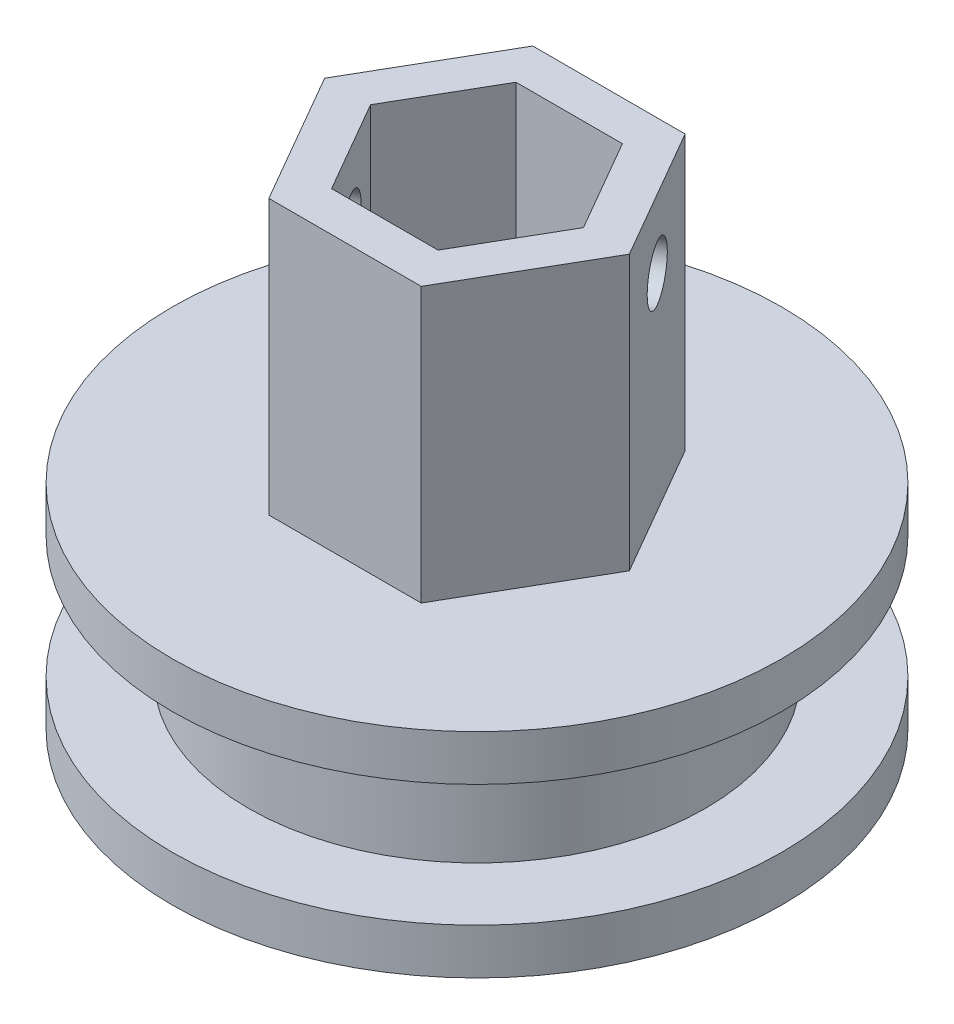
from build123d import *

# Parameters (mm, degrees)
EXTRUDE_3_DEPTH     = 18
SKETCH_2_R          = 1.8
CUT_EXTRUDE_1_DEPTH = 17.325
SKETCH_4_R          = 20
SKETCH_4_R_2        = 1.75
EXTRUDE_4_DEPTH     = 3
SKETCH_5_R          = 15
SKETCH_5_R_2        = 1.75
EXTRUDE_5_DEPTH     = 8
SKETCH_6_R          = 20
SKETCH_6_R_2        = 1.75
EXTRUDE_6_DEPTH     = 3


with BuildPart() as part:
    # 草图1 → 凸台-拉伸3 (new body)
    with BuildSketch(Plane(origin=(0, 0, 0), x_dir=(1, 0, 0), z_dir=(0, 1, 0))):
        Polygon((10, 0), (5, 8.660254038), (-5, 8.660254038), (-10, 0), (-5, -8.660254038), (5, -8.660254038), align=None)
        Polygon((6.985938257, 0), (3.492969129, 6.05), (-3.492969129, 6.05), (-6.985938257, 0), (-3.492969129, -6.05), (3.492969129, -6.05), align=None, mode=Mode.SUBTRACT)
    extrude(amount=-EXTRUDE_3_DEPTH)

    # 草图2 → 切除-拉伸1 (cut)
    with BuildSketch(Plane(origin=(7.5, 0, -4.330127019), x_dir=(-0.5000000000000003, 0, -0.8660254037844386), z_dir=(0.8660254037844386, 0, -0.5000000000000003))):
        with Locations((0, -4.5)):
            Circle(SKETCH_2_R)
    extrude(amount=-CUT_EXTRUDE_1_DEPTH, mode=Mode.SUBTRACT)

    # 草图4 → 凸台-拉伸4 (add)
    with BuildSketch(Plane.XZ.offset(18)):
        with Locations(Location((0, 0, 0), (0, 0, 270))):
            Circle(SKETCH_4_R)
        with Locations(Location((0, 0, 0), (0, 0, 270))):
            Circle(SKETCH_4_R_2, mode=Mode.SUBTRACT)
    extrude(amount=EXTRUDE_4_DEPTH)

    # 草图5 → 凸台-拉伸5 (add)
    with BuildSketch(Plane.XZ.offset(21)):
        with Locations(Location((0, 0, 0), (0, 0, 270))):
            Circle(SKETCH_5_R)
        with Locations(Location((0, 0, 0), (0, 0, 270))):
            Circle(SKETCH_5_R_2, mode=Mode.SUBTRACT)
    extrude(amount=EXTRUDE_5_DEPTH)

    # 草图6 → 凸台-拉伸6 (add)
    with BuildSketch(Plane.XZ.offset(29)):
        with Locations(Location((0, 0, 0), (0, 0, 270))):
            Circle(SKETCH_6_R)
        with Locations(Location((0, 0, 0), (0, 0, 270))):
            Circle(SKETCH_6_R_2, mode=Mode.SUBTRACT)
    extrude(amount=EXTRUDE_6_DEPTH)


solid = part.part
